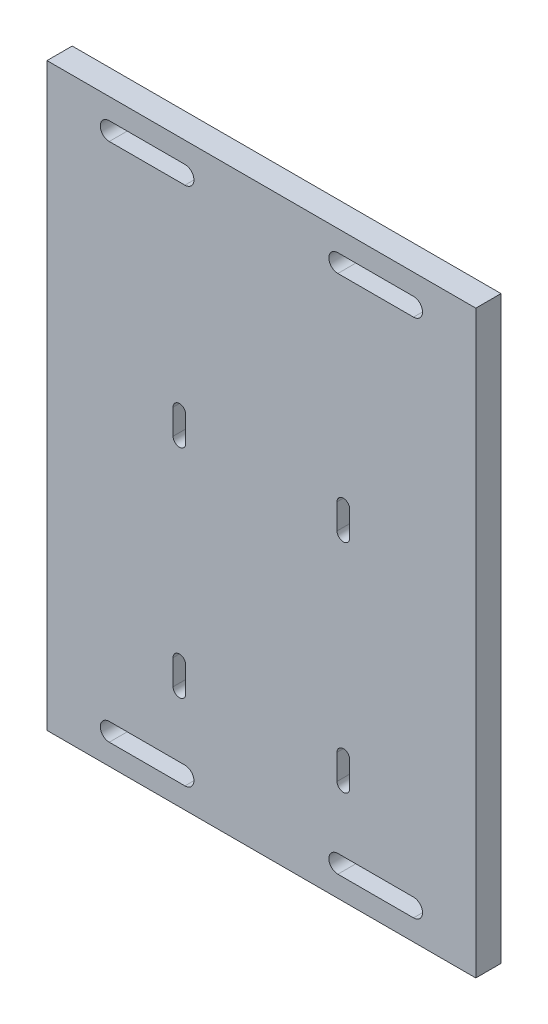
from build123d import *

# Parameters (mm, degrees)
SKETCH1_W           = 170
SKETCH1_H           = 230
BOSS_EXTRUDE1_DEPTH = 10


with BuildPart() as part:
    # Sketch1 → Boss-Extrude1 (new body)
    with BuildSketch(Plane.XY):
        Rectangle(SKETCH1_W, SKETCH1_H)
        with BuildLine():
            Line((30.314685315, 106.695804196), (60.314685315, 106.695804196))
            ThreePointArc((60.314685315, 106.695804196), (63.881118881, 103.129370629), (60.314685315, 99.562937063))
            Line((60.314685315, 99.562937063), (30.314685315, 99.562937063))
            ThreePointArc((30.314685315, 99.562937063), (26.748251748, 103.129370629), (30.314685315, 106.695804196))
        make_face(mode=Mode.SUBTRACT)
        with BuildLine():
            Line((35, -75), (35, -65))
            ThreePointArc((35, -65), (32.5, -62.5), (30, -65))
            Line((30, -65), (30, -75))
            ThreePointArc((30, -75), (32.5, -77.5), (35, -75))
        make_face(mode=Mode.SUBTRACT)
        with BuildLine():
            Line((-30.314685315, 106.695804196), (-60.314685315, 106.695804196))
            ThreePointArc((-60.314685315, 106.695804196), (-63.881118881, 103.129370629), (-60.314685315, 99.562937063))
            Line((-60.314685315, 99.562937063), (-30.314685315, 99.562937063))
            ThreePointArc((-30.314685315, 99.562937063), (-26.748251748, 103.129370629), (-30.314685315, 106.695804196))
        make_face(mode=Mode.SUBTRACT)
        with BuildLine():
            Line((30, 21), (30, 11))
            ThreePointArc((30, 11), (32.5, 8.5), (35, 11))
            Line((35, 11), (35, 21))
            ThreePointArc((35, 21), (32.5, 23.5), (30, 21))
        make_face(mode=Mode.SUBTRACT)
        with BuildLine():
            Line((-30, 21), (-30, 11))
            ThreePointArc((-30, 11), (-32.5, 8.5), (-35, 11))
            Line((-35, 11), (-35, 21))
            ThreePointArc((-35, 21), (-32.5, 23.5), (-30, 21))
        make_face(mode=Mode.SUBTRACT)
        with BuildLine():
            Line((-30, -75), (-30, -65))
            ThreePointArc((-30, -65), (-32.5, -62.5), (-35, -65))
            Line((-35, -65), (-35, -75))
            ThreePointArc((-35, -75), (-32.5, -77.5), (-30, -75))
        make_face(mode=Mode.SUBTRACT)
        with BuildLine():
            Line((-30.314685315, -99.562937063), (-60.314685315, -99.562937063))
            ThreePointArc((-60.314685315, -99.562937063), (-63.881118881, -103.129370629), (-60.314685315, -106.695804196))
            Line((-60.314685315, -106.695804196), (-30.314685315, -106.695804196))
            ThreePointArc((-30.314685315, -106.695804196), (-26.748251748, -103.129370629), (-30.314685315, -99.562937063))
        make_face(mode=Mode.SUBTRACT)
        with BuildLine():
            Line((30.314685315, -99.562937063), (60.314685315, -99.562937063))
            ThreePointArc((60.314685315, -99.562937063), (63.881118881, -103.129370629), (60.314685315, -106.695804196))
            Line((60.314685315, -106.695804196), (30.314685315, -106.695804196))
            ThreePointArc((30.314685315, -106.695804196), (26.748251748, -103.129370629), (30.314685315, -99.562937063))
        make_face(mode=Mode.SUBTRACT)
    extrude(amount=BOSS_EXTRUDE1_DEPTH)


solid = part.part
